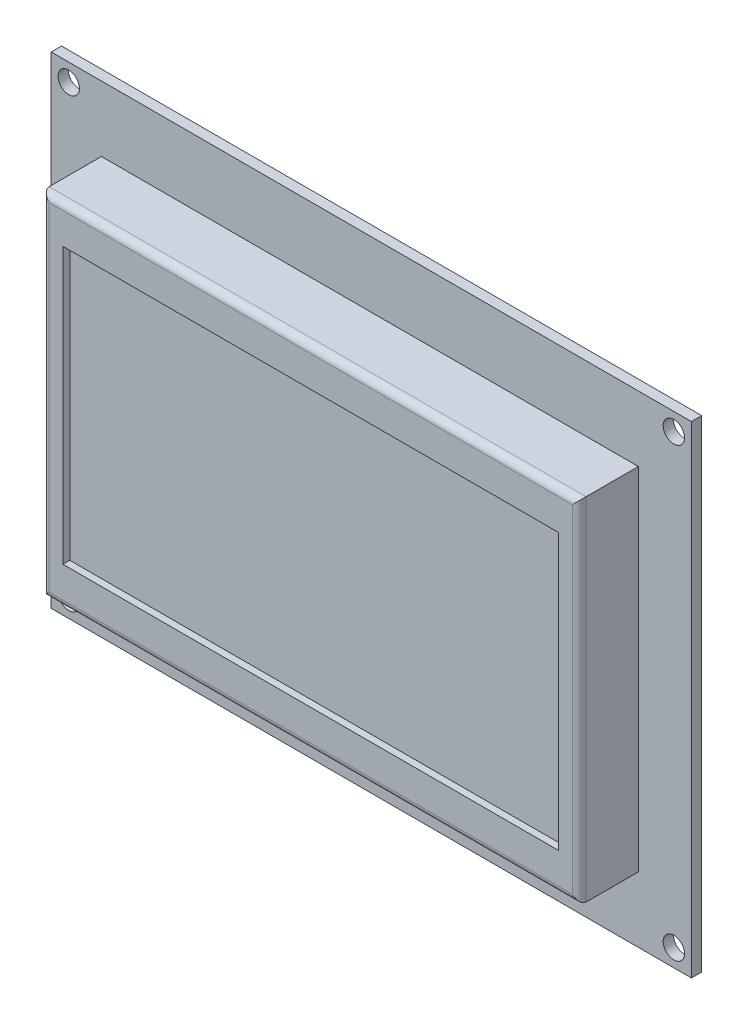
from build123d import *

# Parameters (mm, degrees)
CROQUIS1_W                          = 93
CROQUIS1_H                          = 70
SALIENTE_EXTRUIR1_DEPTH             = 1.5
CROQUIS2_W                          = 78
CROQUIS2_H                          = 51
SALIENTE_EXTRUIR2_DEPTH             = 8.6
DI_METRO_DE_TALADRO_3_1_3_1_1_D     = 3.1
DI_METRO_DE_TALADRO_3_1_3_1_1_DEPTH = 10.1
REDONDEO1_R                         = 1
CROQUIS5_W                          = 72
CROQUIS5_H                          = 40
CORTAR_EXTRUIR1_DEPTH               = 1


with BuildPart() as part:
    # Croquis1 → Saliente-Extruir1 (new body)
    with BuildSketch(Plane.XY.offset(6)):
        with Locations((0, 8.5)):
            Rectangle(CROQUIS1_W, CROQUIS1_H)
    extrude(amount=-SALIENTE_EXTRUIR1_DEPTH)

    # Croquis2 → Saliente-Extruir2 (add)
    with BuildSketch(Plane.XY.offset(6)):
        with Locations((-0.2, 8.5)):
            Rectangle(CROQUIS2_W, CROQUIS2_H)
    extrude(amount=SALIENTE_EXTRUIR2_DEPTH)

    # Diámetro de taladro Ø3.1 (3.1)1
    with Locations(Plane(origin=(0, 0, 4.5), x_dir=(-1, 0, 0), z_dir=(0, 0, -1))):
        with Locations((43.95, -23.95), (-43.95, -23.95), (43.95, 40.95), (-43.95, 40.95)):
            Hole(DI_METRO_DE_TALADRO_3_1_3_1_1_D / 2, depth=DI_METRO_DE_TALADRO_3_1_3_1_1_DEPTH)

    # Redondeo1
    redondeo1_edges = [part.edges().sort_by_distance(p)[0] for p in [
        (-0.2, -17, 14.6),
        (38.8, 8.5, 14.6),
        (-0.2, 34, 14.6),
        (-39.2, 8.5, 14.6),
    ]]
    fillet(redondeo1_edges, radius=REDONDEO1_R)

    # Croquis5 → Cortar-Extruir1 (cut)
    with BuildSketch(Plane.XY.offset(14.6)):
        with Locations((-0.2, 8.5)):
            Rectangle(CROQUIS5_W, CROQUIS5_H)
    extrude(amount=-CORTAR_EXTRUIR1_DEPTH, mode=Mode.SUBTRACT)


solid = part.part
